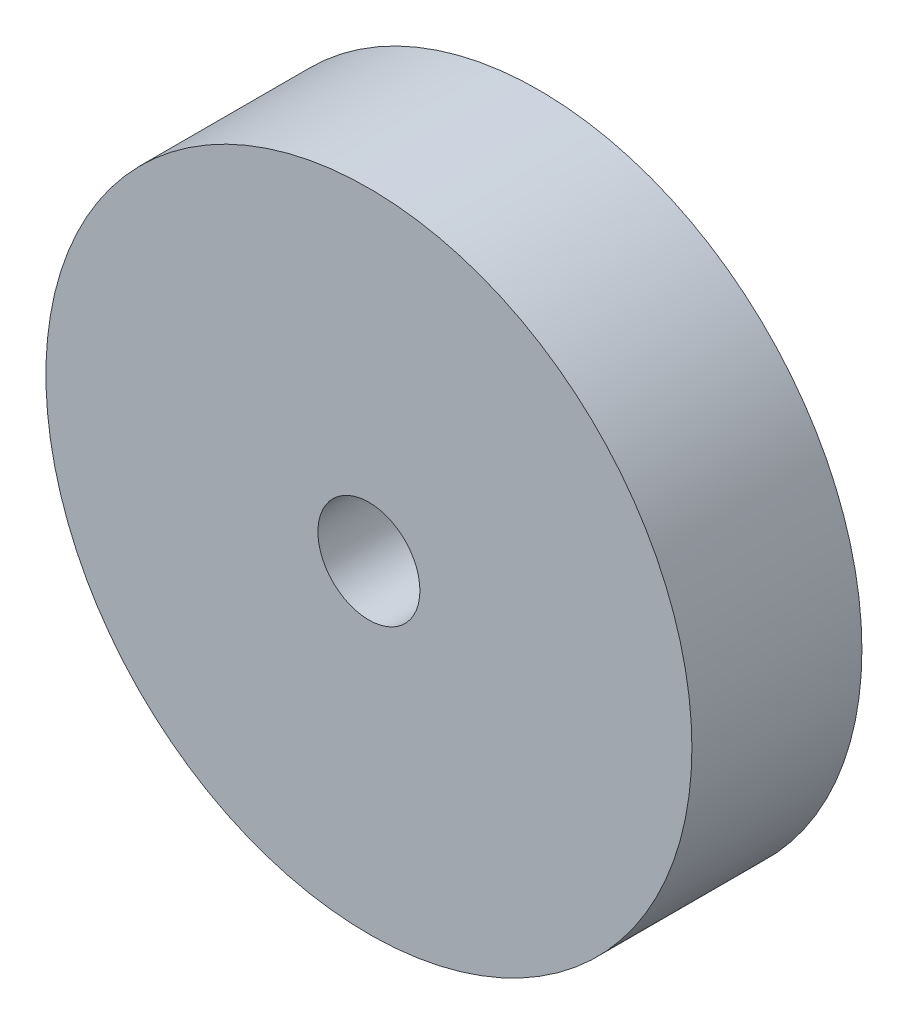
from build123d import *

# Parameters (mm, degrees)
SKETCH_1_R          = 19
EXTRUDE_1_DEPTH     = 10
SKETCH_2_R          = 3
CUT_EXTRUDE_1_DEPTH = 10


with BuildPart() as part:
    # 草图1 → 凸台-拉伸1 (new body)
    with BuildSketch(Plane.XY):
        Circle(SKETCH_1_R)
    extrude(amount=EXTRUDE_1_DEPTH)

    # 草图2 → 切除-拉伸1 (cut)
    with BuildSketch(Plane.XY.offset(10)):
        Circle(SKETCH_2_R)
    extrude(amount=-CUT_EXTRUDE_1_DEPTH, mode=Mode.SUBTRACT)


solid = part.part
